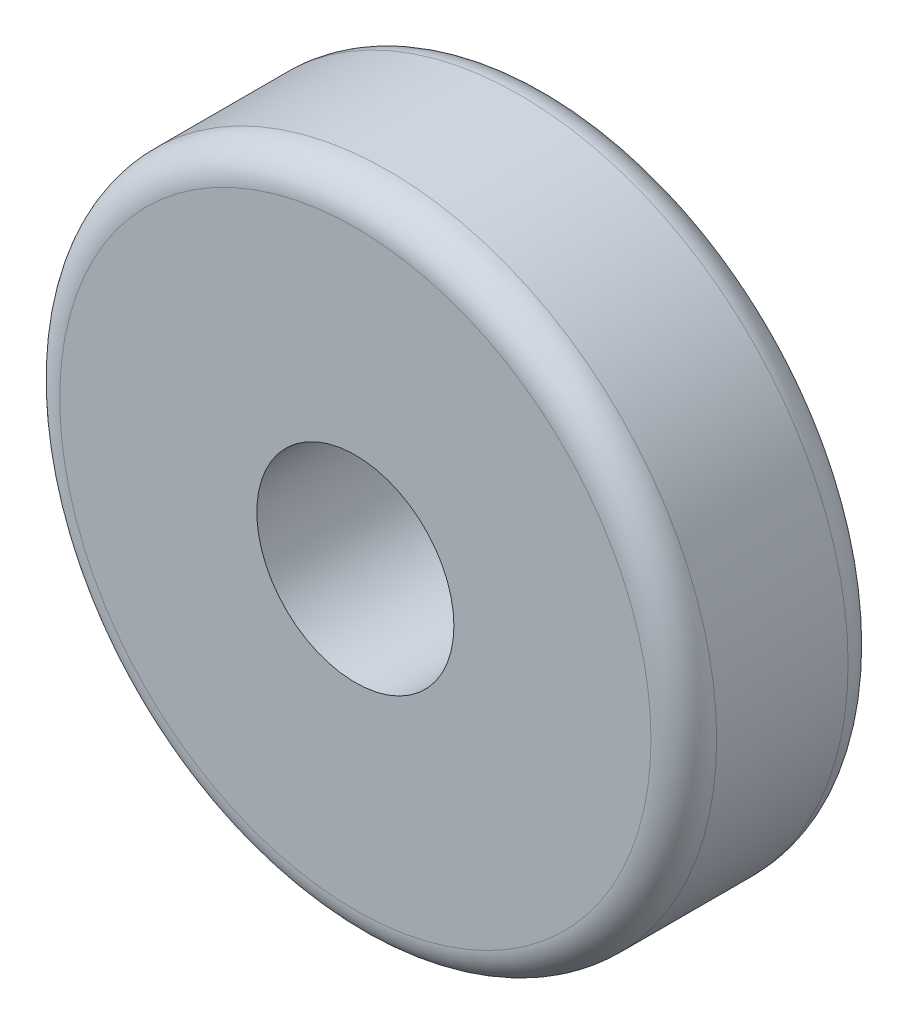
from build123d import *

# Parameters (mm, degrees)
SKETCH_1_R      = 10
SKETCH_1_R_2    = 3
EXTRUDE_1_DEPTH = 6
FILLET_1_R      = 1


with BuildPart() as part:
    # 草图1 → 凸台-拉伸1 (new body)
    with BuildSketch(Plane.XY):
        Circle(SKETCH_1_R)
        Circle(SKETCH_1_R_2, mode=Mode.SUBTRACT)
    extrude(amount=EXTRUDE_1_DEPTH)

    # 圆角1
    fillet_1_edges = [part.edges().sort_by_distance(p)[0] for p in [
        (-10, 0, 0),
        (-10, 0, 6),
    ]]
    fillet(fillet_1_edges, radius=FILLET_1_R)


solid = part.part
